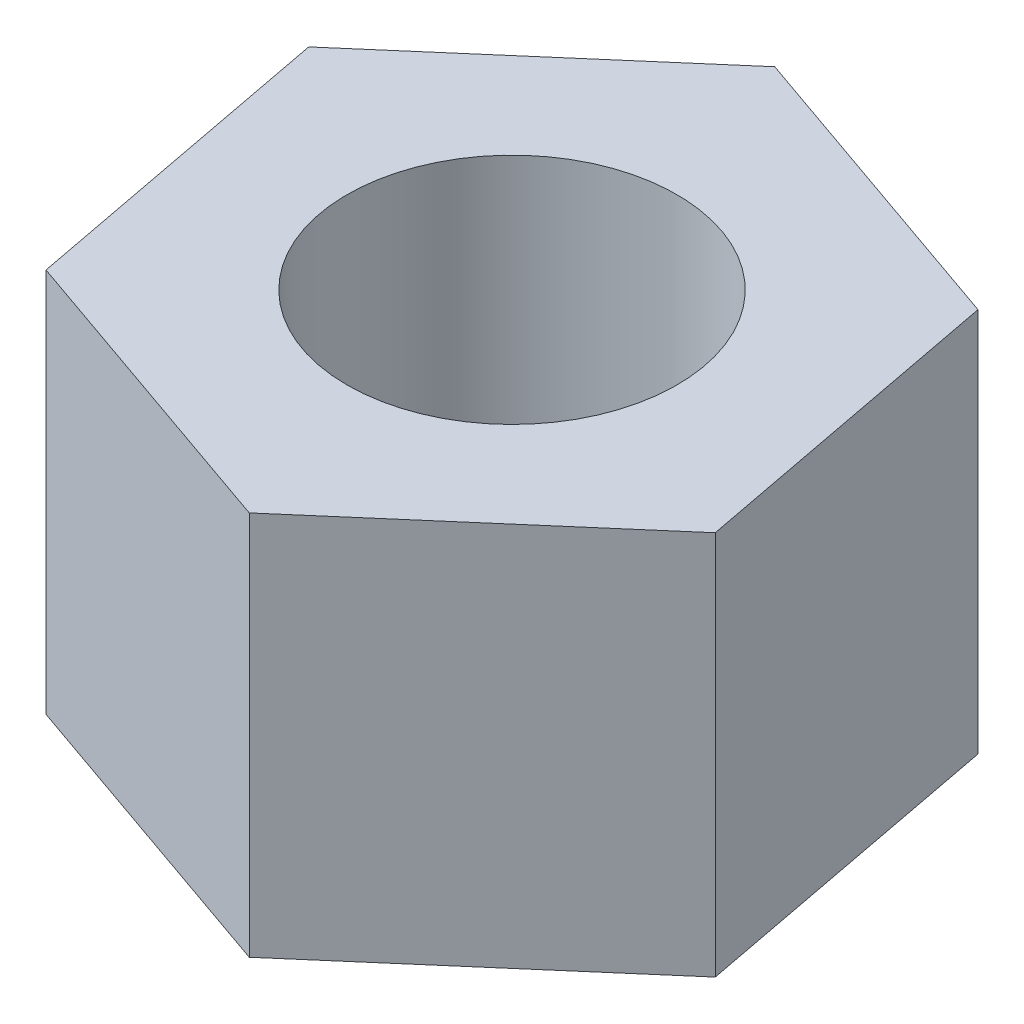
from build123d import *

# Parameters (mm, degrees)
EXTRUDE_1_DEPTH     = 3.5
SKETCH_2_R          = 1.5
CUT_EXTRUDE_1_DEPTH = 6.38662565


with BuildPart() as part:
    # 草图1 → 凸台-拉伸1 (new body)
    with BuildSketch(Plane(origin=(0, 0, 0), x_dir=(1, 0, 0), z_dir=(0, 1, 0))):
        Polygon((0.562271884, -2.951927392), (2.837580054, -0.98902196), (2.27530817, 1.962905432), (-0.562271884, 2.951927392), (-2.837580054, 0.98902196), (-2.27530817, -1.962905432), align=None)
    extrude(amount=EXTRUDE_1_DEPTH)

    # 草图2 → 切除-拉伸1 (cut, through all)
    with BuildSketch(Plane(origin=(0, 3.5, 0), x_dir=(1, 0, 0), z_dir=(0, 1, 0))):
        with Locations(Location((0, 0, 0), (0, 0, 270))):
            Circle(SKETCH_2_R)
    extrude(amount=-CUT_EXTRUDE_1_DEPTH, mode=Mode.SUBTRACT)


solid = part.part
